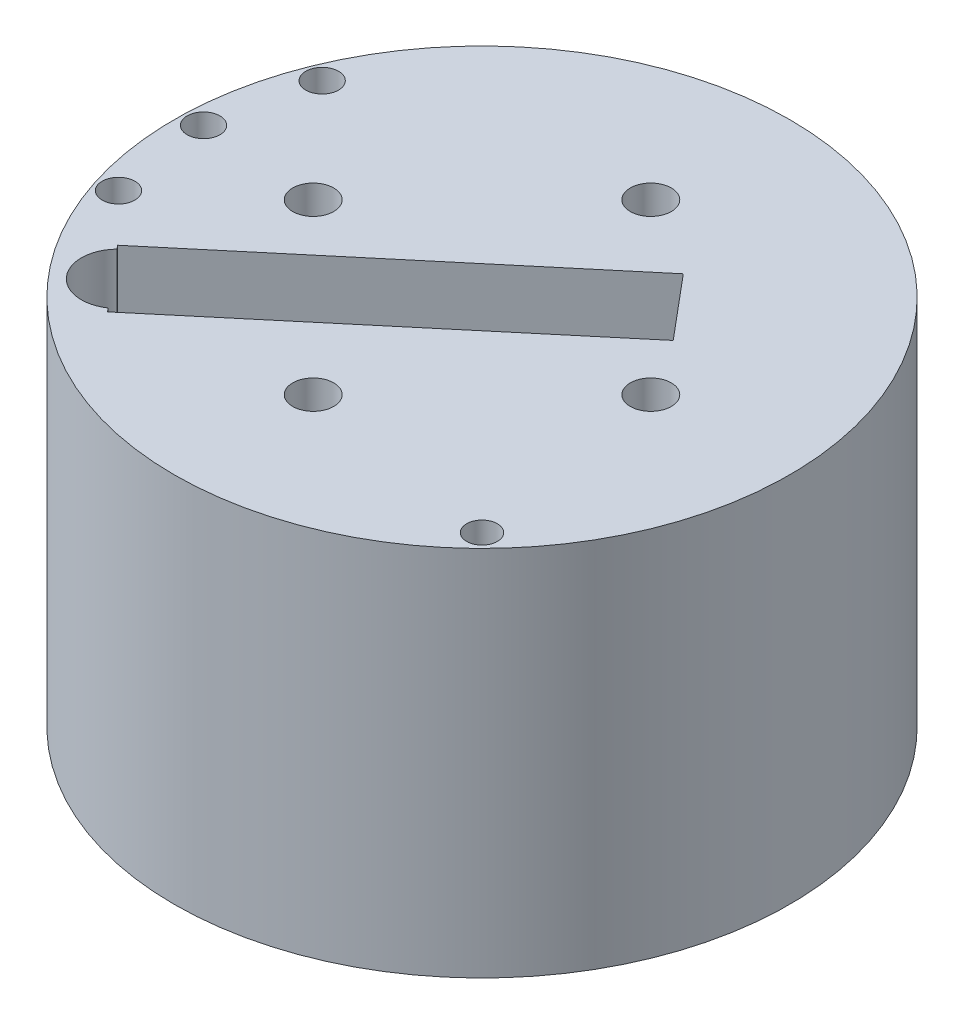
from build123d import *

# Parameters (mm, degrees)
SKETCH2_R           = 47.6885
BOSS_EXTRUDE1_DEPTH = 57.658
SKETCH5_R           = 2.54
SKETCH5_R_2         = 5.6388
CUT_EXTRUDE2_DEPTH  = 89.728975135
SKETCH4_R           = 3.175
CUT_EXTRUDE3_DEPTH  = 89.728975135
CUT_EXTRUDE4_DEPTH  = 43.18
SKETCH11_R          = 6.35
CUT_EXTRUDE7_DEPTH  = 7.62
SKETCH14_R          = 2.067000057
CUT_EXTRUDE8_DEPTH  = 19.05
SKETCH15_R          = 2.38125
CUT_EXTRUDE9_DEPTH  = 66.04


with BuildPart() as part:
    # Sketch2 → Boss-Extrude1 (new body)
    with BuildSketch(Plane(origin=(0, 0, 0), x_dir=(1, 0, 0), z_dir=(0, 1, 0))):
        with Locations(Location((0, 0, 0), (0, 0, 90))):
            Circle(SKETCH2_R)
    extrude(amount=BOSS_EXTRUDE1_DEPTH)

    # Sketch5 → Cut-Extrude2 (cut, through all)
    with BuildSketch(Plane(origin=(0, 57.658, 0), x_dir=(1, 0, 0), z_dir=(0, 1, 0))):
        with Locations(Location((-41.445499463, 16.673368884, 0), (0, 0, 270))):
            Circle(SKETCH5_R)
        with Locations(Location((-44.648658026, 1.492646038, 0), (0, 0, 270))):
            Circle(SKETCH5_R)
        with Locations(Location((-42.466529486, -13.86811195, 0), (0, 0, 270))):
            Circle(SKETCH5_R)
        with Locations(Location((-30.694251769, -25.755535339, 0), (0, 0, 270))):
            Circle(SKETCH5_R_2)
    extrude(amount=-CUT_EXTRUDE2_DEPTH, mode=Mode.SUBTRACT)

    # Sketch4 → Cut-Extrude3 (cut, through all)
    with BuildSketch(Plane(origin=(0, 57.658, 0), x_dir=(1, 0, 0), z_dir=(0, 1, 0))):
        with Locations(Location((-26.162, 0, 0), (0, 0, 270))):
            Circle(SKETCH4_R)
        with Locations(Location((26.162, 0, 0), (0, 0, 270))):
            Circle(SKETCH4_R)
        with Locations(Location((0, 26.162, 0), (0, 0, 270))):
            Circle(SKETCH4_R)
        with Locations(Location((0, -26.162, 0), (0, 0, 270))):
            Circle(SKETCH4_R)
    extrude(amount=-CUT_EXTRUDE3_DEPTH, mode=Mode.SUBTRACT)

    # Sketch6 → Cut-Extrude4 (cut)
    with BuildSketch(Plane(origin=(0, 57.658, 0), x_dir=(1, 0, 0), z_dir=(0, 1, 0))):
        Polygon((-27.050344847, -30.987270671), (20.620600848, 9.013402279), (12.457198205, 18.742166707), (-35.21374749, -21.258506244), align=None)
    extrude(amount=-CUT_EXTRUDE4_DEPTH, mode=Mode.SUBTRACT)

    # Sketch11 → Cut-Extrude7 (cut)
    with BuildSketch(Plane.XZ):
        with Locations(Location((0, 26.162, 0), (0, 0, 270))):
            Circle(SKETCH11_R)
        with Locations(Location((26.162, 0, 0), (0, 0, 270))):
            Circle(SKETCH11_R)
        with Locations(Location((0, -26.162, 0), (0, 0, 270))):
            Circle(SKETCH11_R)
        with Locations(Location((-26.162, 0, 0), (0, 0, 270))):
            Circle(SKETCH11_R)
    extrude(amount=-CUT_EXTRUDE7_DEPTH, mode=Mode.SUBTRACT)

    # Sketch14 → Cut-Extrude8 (cut)
    with BuildSketch(Plane.XZ):
        with Locations(Location((1.356935186, -14.949033782, 0), (0, 0, 270))):
            Circle(SKETCH14_R)
        with Locations(Location((4.523691953, 8.972265338, 0), (0, 0, 270))):
            Circle(SKETCH14_R)
    extrude(amount=-CUT_EXTRUDE8_DEPTH, mode=Mode.SUBTRACT)

    # Sketch15 → Cut-Extrude9 (cut)
    with BuildSketch(Plane.XZ):
        with Locations(Location((31.589006405, 31.589006405, 0), (0, 0, 270))):
            Circle(SKETCH15_R)
    extrude(amount=-CUT_EXTRUDE9_DEPTH, mode=Mode.SUBTRACT)


solid = part.part
